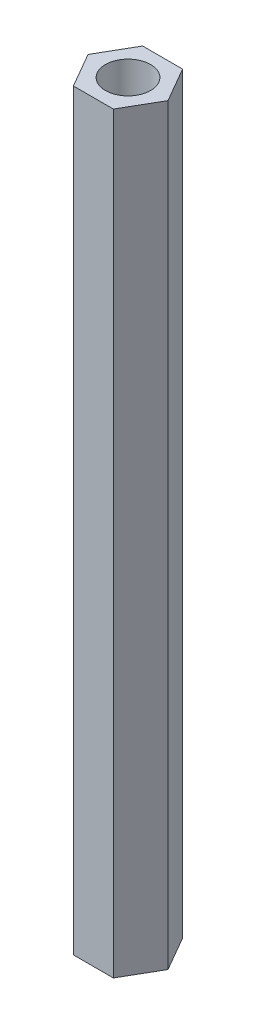
from build123d import *

# Parameters (mm, degrees)
SKETCH_1_R      = 1.5
EXTRUDE_1_DEPTH = 50


with BuildPart() as part:
    # 草图1 → 凸台-拉伸1 (new body)
    with BuildSketch(Plane(origin=(0, 0, 0), x_dir=(1, 0, 0), z_dir=(0, 1, 0))):
        Polygon((2.655811238, 0), (1.327905619, 2.3), (-1.327905619, 2.3), (-2.655811238, 0), (-1.327905619, -2.3), (1.327905619, -2.3), align=None)
        with Locations(Location((0, 0, 0), (0, 0, 270))):
            Circle(SKETCH_1_R, mode=Mode.SUBTRACT)
    extrude(amount=EXTRUDE_1_DEPTH)


solid = part.part
